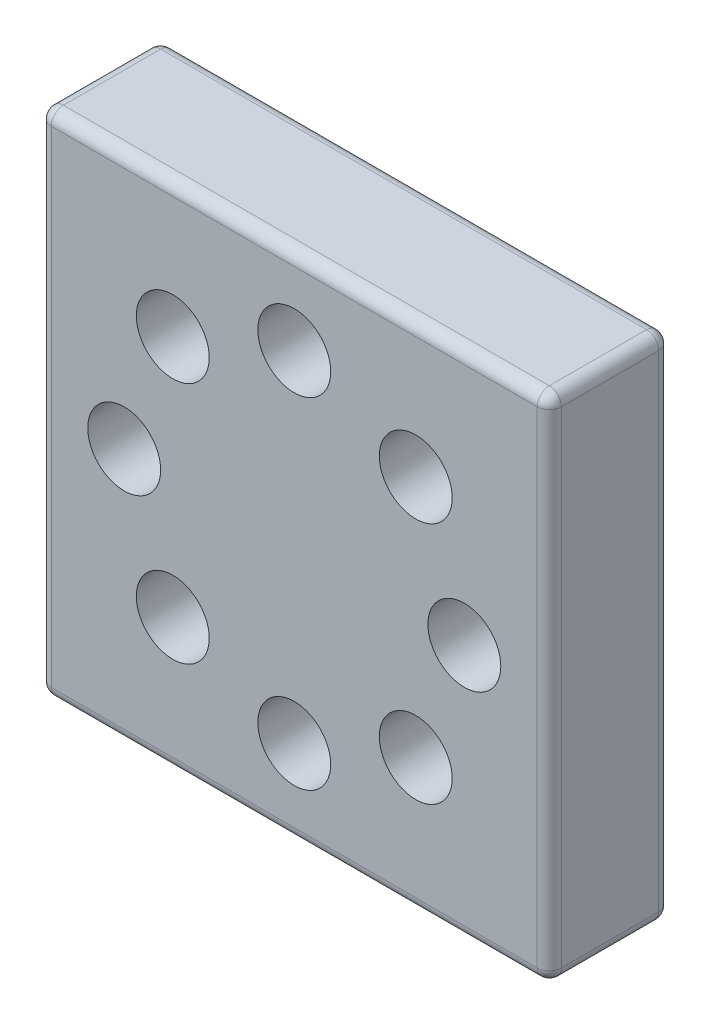
from build123d import *

# Parameters (mm, degrees)
SKETCH1_W           = 21
SKETCH1_H           = 21
SKETCH1_R           = 1.5
BOSS_EXTRUDE1_DEPTH = 5
FILLET1_R           = 0.5


with BuildPart() as part:
    # Sketch1 → Boss-Extrude1 (new body)
    with BuildSketch(Plane.XY):
        Rectangle(SKETCH1_W, SKETCH1_H)
        with Locations((-5.000000296, 5.000000296)):
            Circle(SKETCH1_R, mode=Mode.SUBTRACT)
        with Locations((4.999999704, 4.999999704)):
            Circle(SKETCH1_R, mode=Mode.SUBTRACT)
        with Locations((5.000000296, -5.000000296)):
            Circle(SKETCH1_R, mode=Mode.SUBTRACT)
        with Locations((-4.999999704, -4.999999704)):
            Circle(SKETCH1_R, mode=Mode.SUBTRACT)
        with Locations((0, 7)):
            Circle(SKETCH1_R, mode=Mode.SUBTRACT)
        with Locations((7, 0)):
            Circle(SKETCH1_R, mode=Mode.SUBTRACT)
        with Locations((-7, 0)):
            Circle(SKETCH1_R, mode=Mode.SUBTRACT)
        with Locations((0, -7)):
            Circle(SKETCH1_R, mode=Mode.SUBTRACT)
    extrude(amount=BOSS_EXTRUDE1_DEPTH)

    # Fillet1
    fillet1_edges = [part.edges().sort_by_distance(p)[0] for p in [
        (-10.5, 0, 5),
        (0, -10.5, 5),
        (10.5, 0, 5),
        (0, -10.5, 0),
        (-10.5, 0, 0),
        (0, 10.5, 0),
        (10.5, 0, 0),
        (10.5, -10.5, 2.5),
        (-10.5, -10.5, 2.5),
        (-10.5, 10.5, 2.5),
        (10.5, 10.5, 2.5),
        (0, 10.5, 5),
    ]]
    fillet(fillet1_edges, radius=FILLET1_R)


solid = part.part
